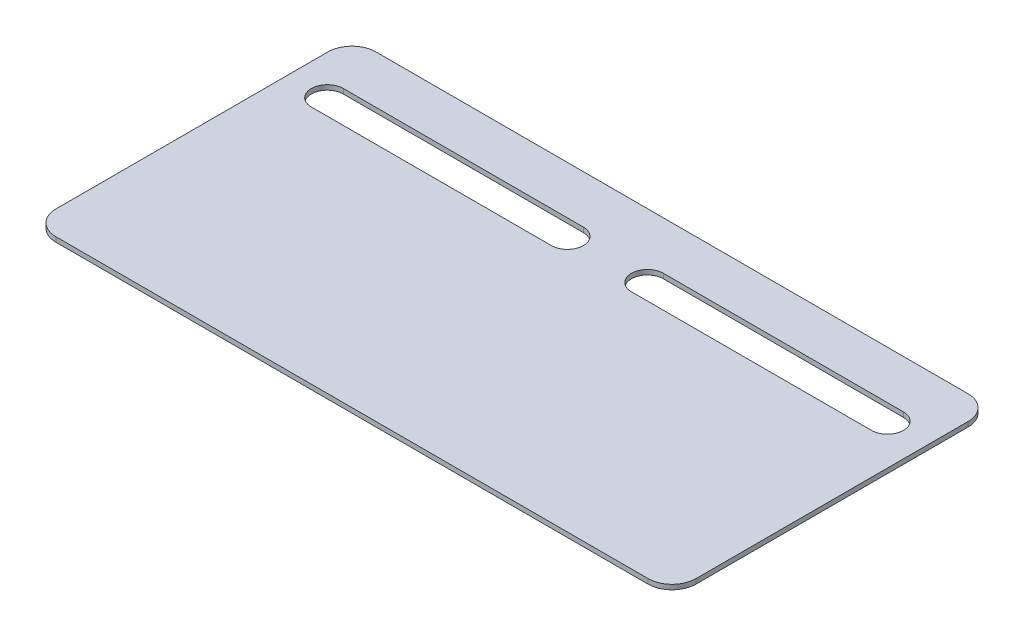
from build123d import *

# Parameters (mm, degrees)
EXTRUDE_1_DEPTH     = 3
CUT_EXTRUDE_3_DEPTH = 3


with BuildPart() as part:
    # 草图1 → 凸台-拉伸1 (new body)
    with BuildSketch(Plane(origin=(0, 0, 0), x_dir=(1, 0, 0), z_dir=(0, 1, 0))):
        with BuildLine():
            Line((-184.615743852, 100), (185.384256148, 100))
            ThreePointArc((185.384256148, 100), (195.990857866, 95.606601718), (200.384256148, 85))
            Line((200.384256148, 85), (200.384256148, -85))
            ThreePointArc((200.384256148, -85), (195.990857866, -95.606601718), (185.384256148, -100))
            Line((185.384256148, -100), (-184.615743852, -100))
            ThreePointArc((-184.615743852, -100), (-195.22234557, -95.606601718), (-199.615743852, -85))
            Line((-199.615743852, -85), (-199.615743852, 85))
            ThreePointArc((-199.615743852, 85), (-195.22234557, 95.606601718), (-184.615743852, 100))
        make_face()
    extrude(amount=EXTRUDE_1_DEPTH)

    # 草图2 → 切除-拉伸3 (cut)
    with BuildSketch(Plane(origin=(0, 3, 0), x_dir=(1, 0, 0), z_dir=(0, 1, 0))):
        with BuildLine():
            Line((-175, 70), (-25, 70))
            ThreePointArc((-25, 70), (-15, 60), (-25, 50))
            Line((-25, 50), (-175, 50))
            ThreePointArc((-175, 50), (-185, 60), (-175, 70))
        make_face()
        with BuildLine():
            Line((25, 50), (175, 50))
            ThreePointArc((175, 50), (185, 60), (175, 70))
            Line((175, 70), (25, 70))
            ThreePointArc((25, 70), (15, 60), (25, 50))
        make_face()
    extrude(amount=-CUT_EXTRUDE_3_DEPTH, mode=Mode.SUBTRACT)


solid = part.part
